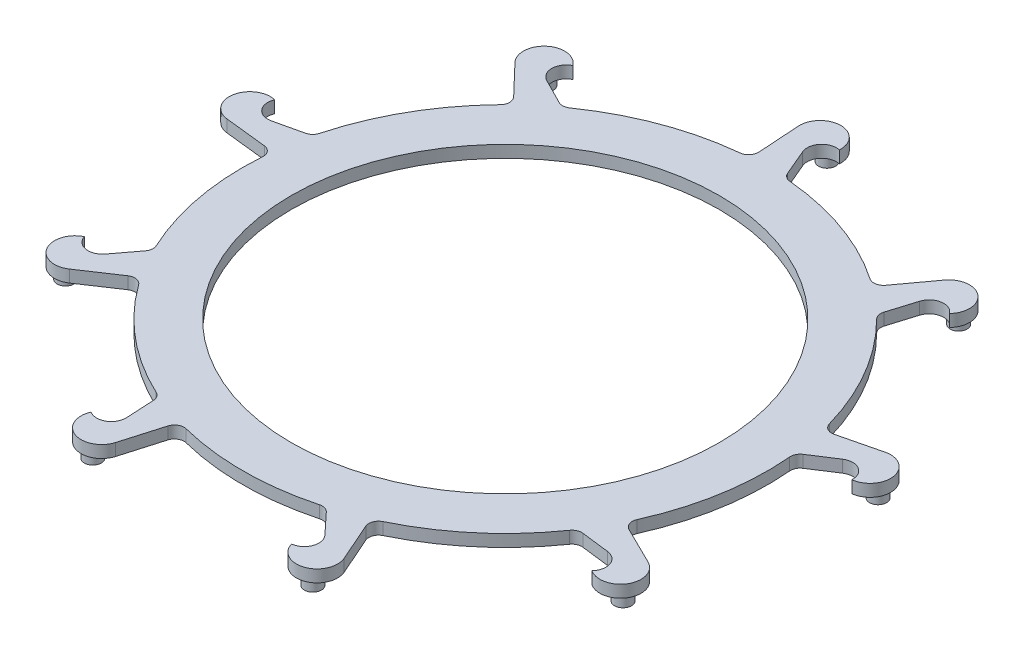
from build123d import *

# Parameters (mm, degrees)
SKETCH1_R           = 68.659375
SKETCH1_R_2         = 55.959375
BOSS_EXTRUDE1_DEPTH = 3.175
BOSS_EXTRUDE2_START = -3.175
BOSS_EXTRUDE2_DEPTH = 3.175
CIRPATTERN1_COUNT   = 9
SKETCH3_R           = 2.2225
BOSS_EXTRUDE3_DEPTH = 6.35
CIRPATTERN13_COUNT  = 9


with BuildPart() as part:
    # Sketch1 → Boss-Extrude1 (new body)
    with BuildSketch(Plane(origin=(0, 0, 0), x_dir=(1, 0, 0), z_dir=(0, 1, 0))):
        with Locations(Location((0, 0, 0), (0, 0, 270))):
            Circle(SKETCH1_R)
        with Locations(Location((0, 0, 0), (0, 0, 270))):
            Circle(SKETCH1_R_2, mode=Mode.SUBTRACT)
    extrude(amount=BOSS_EXTRUDE1_DEPTH)

    # Sketch2 → Boss-Extrude2 (add)
    with BuildSketch(Plane(origin=(0, 3.175, 0), x_dir=(1, 0, 0), z_dir=(0, 1, 0)).offset(BOSS_EXTRUDE2_START)):
        with BuildLine():
            Line((-4.653697789, 71.001707707), (-5.372788209, 81.972907412))
            ThreePointArc((-5.372788209, 81.972907412), (0, 87.709375), (5.372788209, 81.972907412))
            ThreePointArc((5.372788209, 81.972907412), (1.580107525, 80.725221164), (0.983574692, 76.777399446))
            Line((0.983574692, 76.777399446), (3.889375, 69.933810414))
            ThreePointArc((3.889375, 69.933810414), (4.734169071, 68.871766239), (6.005193091, 68.39625305))
            ThreePointArc((6.005193091, 68.39625305), (-0.46538454, 68.657797755), (-6.931822104, 68.308561818))
            ThreePointArc((-6.931822104, 68.308561818), (-5.249012804, 69.195180628), (-4.653697789, 71.001707707))
        make_face()
    boss_extrude2 = extrude(amount=BOSS_EXTRUDE2_DEPTH)

    # CirPattern1: Boss-Extrude2 ×9 about axis
    cirpattern1_axis = Axis((0, 0, 0), (0, 1, 0))
    for i in range(1, CIRPATTERN1_COUNT):
        add(boss_extrude2.rotate(cirpattern1_axis, i * 360 / CIRPATTERN1_COUNT))

    # Sketch3 → Boss-Extrude3 (add)
    with BuildSketch(Plane(origin=(0, 3.175, 0), x_dir=(1, 0, 0), z_dir=(0, 1, 0))):
        with Locations(Location((0, 84.132166, 0), (0, 0, 270))):
            Circle(SKETCH3_R)
    boss_extrude3 = extrude(amount=-BOSS_EXTRUDE3_DEPTH)

    # CirPattern13: Boss-Extrude3 ×9 about axis
    cirpattern13_axis = Axis((0, 0, 0), (0, 1, 0))
    for i in range(1, CIRPATTERN13_COUNT):
        add(boss_extrude3.rotate(cirpattern13_axis, i * 360 / CIRPATTERN13_COUNT))


solid = part.part
